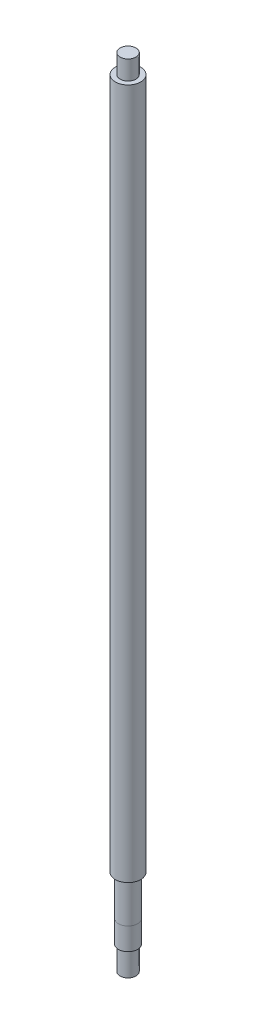
from build123d import *

# Parameters (mm, degrees)
SKETCH1_R        = 8
EXTRUSION1_DEPTH = 500
SKETCH2_R        = 8
EXTRUSION2_DEPTH = 50
EXTRUSION3_START = 50
SKETCH3_R        = 8
EXTRUSION3_DEPTH = 50
SKETCH4_R        = 8
SKETCH4_R_2      = 6
THREAD1_DEPTH    = 14
SKETCH5_R        = 8
SKETCH5_R_2      = 6.05
EXTRUSION5_DEPTH = 25
SKETCH6_R        = 5
EXTRUSION6_DEPTH = 15
EXTRUSION7_START = -27.101
SKETCH7_R        = 8
EXTRUSION7_DEPTH = 27.101
EXTRUSION8_START = 12
SKETCH8_R        = 5
EXTRUSION8_DEPTH = 12


with BuildPart() as part:
    # Sketch1 → Extrusion1 (new body)
    with BuildSketch(Plane(origin=(0, 0, 0), x_dir=(-1, 0, 0), z_dir=(0, 1, 0))):
        with Locations(Location((0, 0, 0), (0, 0, 90))):
            Circle(SKETCH1_R)
    extrude(amount=EXTRUSION1_DEPTH)

    # Sketch2 → Extrusion2 (cut)
    with BuildSketch(Plane.XZ):
        with Locations(Location((0, 0, 0), (0, 0, 270))):
            Circle(SKETCH2_R)
    extrude(amount=-EXTRUSION2_DEPTH, mode=Mode.SUBTRACT)

    # Sketch3 → Extrusion3 (add)
    with BuildSketch(Plane.XZ.offset(-50).offset(EXTRUSION3_START)):
        with Locations(Location((0, 0, 0), (0, 0, 270))):
            Circle(SKETCH3_R)
    extrude(amount=-EXTRUSION3_DEPTH)

    # Sketch4 → Thread1 (cut)
    with BuildSketch(Plane.XZ):
        with Locations(Location((0, 0, 0), (0, 0, 270))):
            Circle(SKETCH4_R)
        with Locations(Location((0, 0, 0), (0, 0, 270))):
            Circle(SKETCH4_R_2, mode=Mode.SUBTRACT)
    extrude(amount=-THREAD1_DEPTH, mode=Mode.SUBTRACT)

    # Sketch5 → Extrusion5 (cut)
    with BuildSketch(Plane.XZ.offset(-14)):
        with Locations(Location((0, 0, 0), (0, 0, 270))):
            Circle(SKETCH5_R)
        with Locations(Location((0, 0, 0), (0, 0, 270))):
            Circle(SKETCH5_R_2, mode=Mode.SUBTRACT)
    extrude(amount=-EXTRUSION5_DEPTH, mode=Mode.SUBTRACT)

    # Sketch6 → Extrusion6 (add)
    with BuildSketch(Plane.XZ):
        with Locations(Location((0, 0, 0), (0, 0, 270))):
            Circle(SKETCH6_R)
    extrude(amount=EXTRUSION6_DEPTH)

    # Sketch7 → Extrusion7 (cut)
    with BuildSketch(Plane(origin=(0, 500, 0), x_dir=(-1, 0, 0), z_dir=(0, 1, 0)).offset(EXTRUSION7_START)):
        with Locations(Location((0, 0, 0), (0, 0, 270))):
            Circle(SKETCH7_R)
    extrude(amount=EXTRUSION7_DEPTH, mode=Mode.SUBTRACT)

    # Sketch8 → Extrusion8 (add)
    with BuildSketch(Plane(origin=(0, 472.899, 0), x_dir=(-1, 0, 0), z_dir=(0, 1, 0)).offset(EXTRUSION8_START)):
        with Locations(Location((0, 0, 0), (0, 0, 270))):
            Circle(SKETCH8_R)
    extrude(amount=-EXTRUSION8_DEPTH)


solid = part.part
